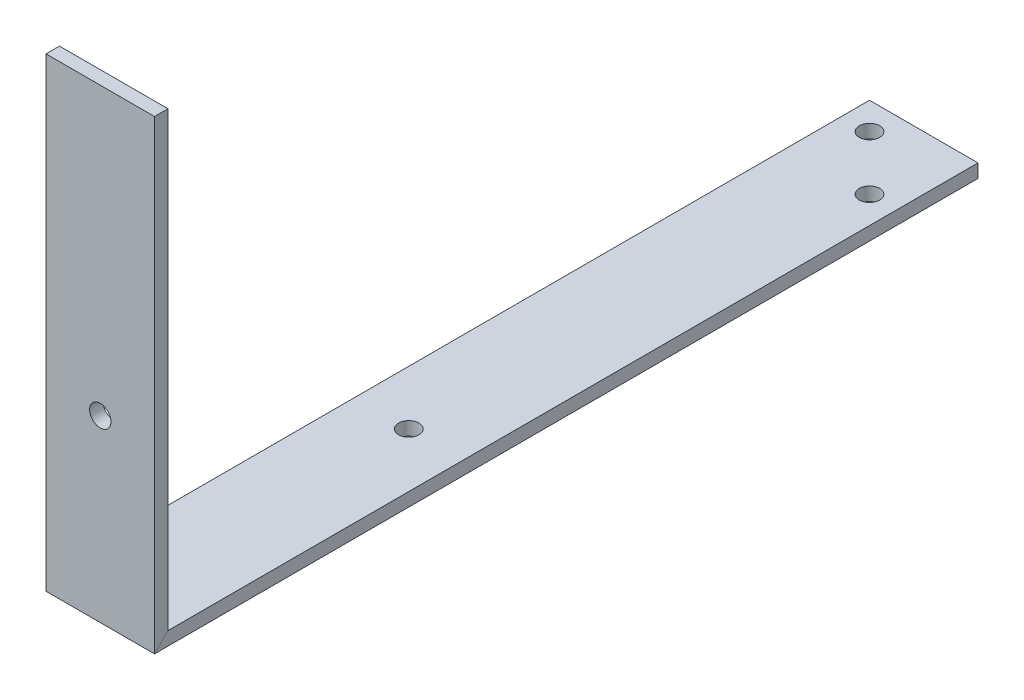
from build123d import *

# Parameters (mm, degrees)
CROQUIS2_W              = 50.8
CROQUIS2_H              = 6.31
CROQUIS3_W              = 50.8
CROQUIS3_H              = 6.31
CROQUIS4_W              = 60
CROQUIS4_H              = 53.155
SALIENTE_EXTRUIR1_DEPTH = 6.31
CROQUIS5_W              = 60
CROQUIS5_H              = 6.31
CORTAR_EXTRUIR1_DEPTH   = 6.31
CORTAR_EXTRUIR2_DEPTH   = 634
CROQUIS8_W              = 50.8
CROQUIS8_H              = 6.31
SALIENTE_EXTRUIR2_DEPTH = 63.5
CROQUIS9_R              = 5
CORTAR_EXTRUIR3_DEPTH   = 10
CROQUIS10_W             = 790.847933
CROQUIS10_H             = 6.31
CORTAR_EXTRUIR4_DEPTH   = 286
CROQUIS11_W             = 50.8
CROQUIS11_H             = 6.31
CROQUIS11_W_2           = 210
CORTAR_EXTRUIR5_DEPTH   = 13.11
CROQUIS12_W             = 50.8
CROQUIS12_H             = 6.31
SALIENTE_EXTRUIR3_DEPTH = 6.35
CROQUIS13_W             = 50.8
CROQUIS13_H             = 6.35
CORTAR_EXTRUIR6_DEPTH   = 6.35
CROQUIS14_W             = 260.8
CROQUIS14_H             = 6.31
CORTAR_EXTRUIR7_DEPTH   = 6.31
CROQUIS15_W             = 50.8
CROQUIS15_H             = 6.31
CORTAR_EXTRUIR8_DEPTH   = 6.31
CROQUIS16_W             = 78.776397836
CROQUIS16_H             = 454.479218284
CORTAR_EXTRUIR9_DEPTH   = 128
CROQUIS22_R             = 4.7625
CORTAR_EXTRUIR15_DEPTH  = 33
CROQUIS24_R             = 5.000000022
CORTAR_EXTRUIR18_DEPTH  = 33
CROQUIS25_R             = 4.7625
CORTAR_EXTRUIR19_DEPTH  = 50
CROQUIS26_W             = 50.8
CROQUIS26_H             = 6.31
SALIENTE_EXTRUIR4_DEPTH = 100


with BuildPart() as part:
    # Barrer1: sweep along a curve in space
    with BuildLine() as barrer1_path:
        Line((0, 0, 0), (0, -567.24, 0))
        Line((0, -567.24, 0), (0, -567.24, 336.2))
        Line((0, -567.24, 336.2), (1786.7, -567.24, 336.2))
        Line((1786.7, -567.24, 336.2), (1786.7, -567.24, 693.16))
        Line((1786.7, -567.24, 693.16), (1786.7, -436.23, 693.16))
        Line((1786.7, -436.23, 693.16), (1786.7, -436.23, 1487.162933))
    # Croquis2 → Barrer1 (sweep)
    with BuildSketch(Plane(origin=(0, 0, 0), x_dir=(1, 0, 0), z_dir=(0, 1, 0))):
        Rectangle(CROQUIS2_W, CROQUIS2_H)
        with Locations((210, 0)):
            Rectangle(CROQUIS2_W, CROQUIS2_H)
    sweep(path=barrer1_path.line, transition=Transition.RIGHT)

    # Barrer4: sweep along a curve in space
    with BuildLine() as barrer4_path:
        Line((-0.201028049, -3.155, -3.155), (-0.201028049, -3.155, -207.155))
        Line((-0.201028049, -3.155, -207.155), (-0.201028049, -53.155, -207.155))
    # Croquis3 → Barrer4 (sweep)
    with BuildSketch(Plane(origin=(0, 0, -3.155), x_dir=(-1, 0, 0), z_dir=(0, 0, -1))):
        with Locations((-210, -3.155)):
            Rectangle(CROQUIS3_W, CROQUIS3_H)
        with Locations((0, -3.155)):
            Rectangle(CROQUIS3_W, CROQUIS3_H)
    sweep(path=barrer4_path.line, transition=Transition.RIGHT)

    # Croquis4 → Saliente-Extruir1 (add)
    with BuildSketch(Plane(origin=(0, 0, -210.31), x_dir=(-1, 0, 0), z_dir=(0, 0, -1))):
        with Locations((-154.6, -26.5775)):
            Rectangle(CROQUIS4_W, CROQUIS4_H)
    extrude(amount=-SALIENTE_EXTRUIR1_DEPTH)

    # Croquis5 → Cortar-Extruir1 (cut)
    with BuildSketch(Plane.XY.offset(-204)):
        with Locations((154.6, -3.155)):
            Rectangle(CROQUIS5_W, CROQUIS5_H)
    extrude(amount=-CORTAR_EXTRUIR1_DEPTH, mode=Mode.SUBTRACT)

    # Croquis7 → Cortar-Extruir2 (cut)
    with BuildSketch(Plane(origin=(0, 0, 0), x_dir=(1, 0, 0), z_dir=(0, 1, 0))):
        Polygon((1761.3, -361.6), (2022.1, -361.6), (2022.1, 278.600557529), (-188.115947115, 278.600557529), (-188.115947115, -361.6), align=None)
    extrude(amount=-CORTAR_EXTRUIR2_DEPTH, mode=Mode.SUBTRACT)

    # Croquis8 → Saliente-Extruir2 (add)
    with BuildSketch(Plane(origin=(0, 0, 361.6), x_dir=(-1, 0, 0), z_dir=(0, 0, -1))):
        with Locations((-1786.7, -567.24)):
            Rectangle(CROQUIS8_W, CROQUIS8_H)
    extrude(amount=SALIENTE_EXTRUIR2_DEPTH)

    # Croquis9 → Cortar-Extruir3 (cut)
    with BuildSketch(Plane(origin=(0, -433.075, 0), x_dir=(1, 0, 0), z_dir=(0, 1, 0))):
        with Locations(Location((1786.7, -1454.162933, 0), (0, 0, 270))):
            Circle(CROQUIS9_R)
        with Locations(Location((1786.7, -1234.162933, 0), (0, 0, 270))):
            Circle(CROQUIS9_R)
        with Locations(Location((1996.7, -1234.162933, 0), (0, 0, 270))):
            Circle(CROQUIS9_R)
        with Locations(Location((1996.7, -1454.162933, 0), (0, 0, 270))):
            Circle(CROQUIS9_R)
    extrude(amount=-CORTAR_EXTRUIR3_DEPTH, mode=Mode.SUBTRACT)

    # Croquis10 → Cortar-Extruir4 (cut)
    with BuildSketch(Plane(origin=(2022.1, 0, 0), x_dir=(0, 0, -1), z_dir=(1, 0, 0))):
        with Locations((-1091.7389665, -436.23)):
            Rectangle(CROQUIS10_W, CROQUIS10_H)
    extrude(amount=-CORTAR_EXTRUIR4_DEPTH, mode=Mode.SUBTRACT)

    # Croquis11 → Cortar-Extruir5 (cut)
    with BuildSketch(Plane(origin=(0, -433.075, 0), x_dir=(1, 0, 0), z_dir=(0, 1, 0))):
        with Locations((1996.7, -693.16)):
            Rectangle(CROQUIS11_W, CROQUIS11_H)
        with Locations((1866.3, -693.16)):
            Rectangle(CROQUIS11_W_2, CROQUIS11_H)
    extrude(amount=-CORTAR_EXTRUIR5_DEPTH, mode=Mode.SUBTRACT)

    # Croquis12 → Saliente-Extruir3 (add)
    with BuildSketch(Plane(origin=(0, 0, 361.6), x_dir=(-1, 0, 0), z_dir=(0, 0, -1))):
        with Locations((-1996.7, -567.24)):
            Rectangle(CROQUIS12_W, CROQUIS12_H)
    extrude(amount=SALIENTE_EXTRUIR3_DEPTH)

    # Croquis13 → Cortar-Extruir6 (cut)
    with BuildSketch(Plane(origin=(0, -564.085, 0), x_dir=(1, 0, 0), z_dir=(0, 1, 0))):
        with Locations((1786.7, -301.275)):
            Rectangle(CROQUIS13_W, CROQUIS13_H)
    extrude(amount=-CORTAR_EXTRUIR6_DEPTH, mode=Mode.SUBTRACT)

    # Croquis14 → Cortar-Extruir7 (cut)
    with BuildSketch(Plane(origin=(0, -446.185, 0), x_dir=(1, 0, 0), z_dir=(0, 1, 0))):
        with Locations((1891.7, -693.16)):
            Rectangle(CROQUIS14_W, CROQUIS14_H)
    extrude(amount=-CORTAR_EXTRUIR7_DEPTH, mode=Mode.SUBTRACT)

    # Croquis15 → Cortar-Extruir8 (cut)
    with BuildSketch(Plane(origin=(0, 0, 304.45), x_dir=(-1, 0, 0), z_dir=(0, 0, -1))):
        with Locations((-1786.7, -567.24)):
            Rectangle(CROQUIS15_W, CROQUIS15_H)
    extrude(amount=-CORTAR_EXTRUIR8_DEPTH, mode=Mode.SUBTRACT)

    # Croquis16 → Cortar-Extruir9 (cut)
    with BuildSketch(Plane(origin=(0, -452.495, 0), x_dir=(1, 0, 0), z_dir=(0, 1, 0))):
        with Locations((1993.809618139, -557.908989907)):
            Rectangle(CROQUIS16_W, CROQUIS16_H)
    extrude(amount=-CORTAR_EXTRUIR9_DEPTH, mode=Mode.SUBTRACT)

    # Croquis22 → Cortar-Extruir15 (cut)
    with BuildSketch(Plane(origin=(0, -564.085, 0), x_dir=(1, 0, 0), z_dir=(0, 1, 0))):
        with Locations(Location((1786.7, -551.855, 0), (0, 0, 270))):
            Circle(CROQUIS22_R)
    extrude(amount=-CORTAR_EXTRUIR15_DEPTH, mode=Mode.SUBTRACT)

    # Croquis24 → Cortar-Extruir18 (cut)
    with BuildSketch(Plane(origin=(0, 0, 690.005), x_dir=(-1, 0, 0), z_dir=(0, 0, -1))):
        with Locations((-1786.700000078, -486.49871274)):
            Circle(CROQUIS24_R)
    extrude(amount=-CORTAR_EXTRUIR18_DEPTH, mode=Mode.SUBTRACT)

    # Croquis25 → Cortar-Extruir19 (cut)
    with BuildSketch(Plane(origin=(0, -570.395, 0), x_dir=(-1, 0, 0), z_dir=(0, -1, 0))):
        with Locations(Location((-1799.399999999, -348.862204666, 0), (0, 0, 90))):
            Circle(CROQUIS25_R)
        with Locations(Location((-1773.999999999, -323.462204666, 0), (0, 0, 90))):
            Circle(CROQUIS25_R)
    extrude(amount=-CORTAR_EXTRUIR19_DEPTH, mode=Mode.SUBTRACT)

    # Croquis26 → Saliente-Extruir4 (add)
    with BuildSketch(Plane(origin=(0, -452.495, 0), x_dir=(1, 0, 0), z_dir=(0, 1, 0))):
        with Locations((1786.7, -693.16)):
            Rectangle(CROQUIS26_W, CROQUIS26_H)
    extrude(amount=SALIENTE_EXTRUIR4_DEPTH)


solid = part.part
